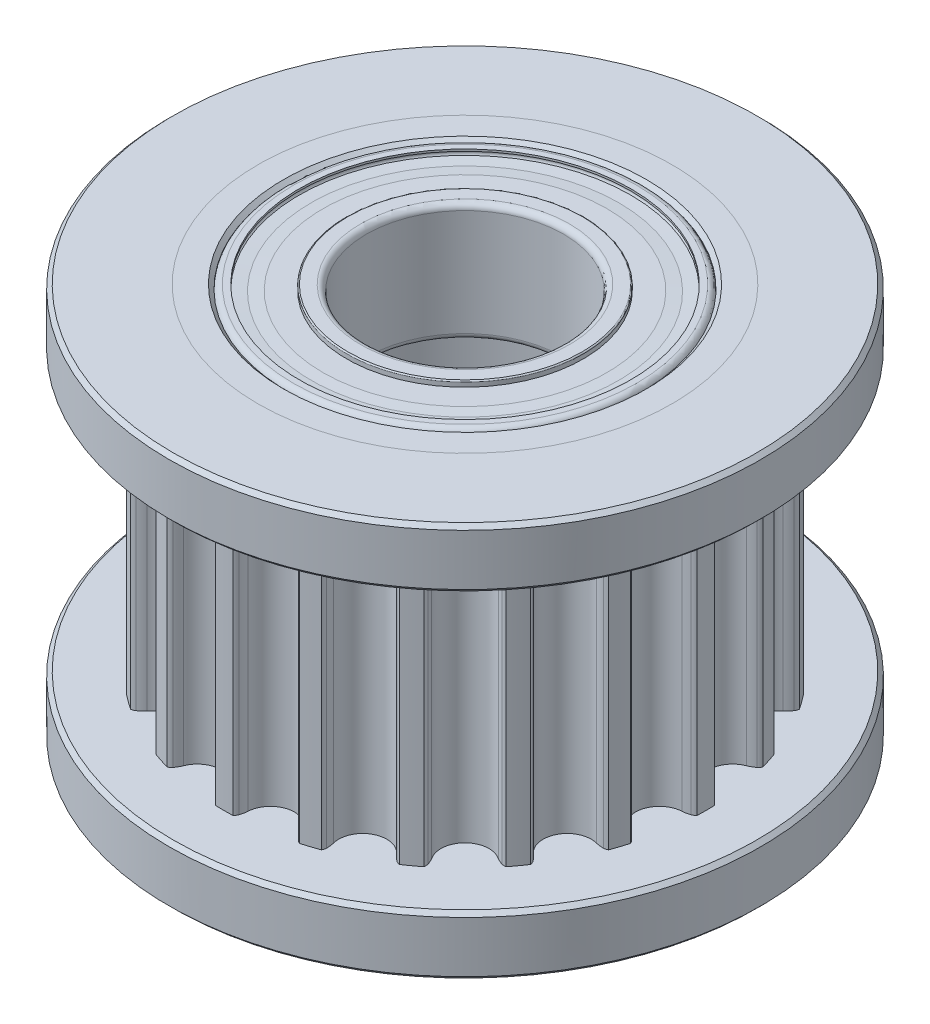
from build123d import *

# Parameters (mm, degrees)
ZKOSEN_1_SIZE            = 0.1
ZAOBLIT1_R               = 0.1
SKICA11_OUTSIDE_W        = 18.214
SKICA11_OUTSIDE_H        = 18.214
ODEBRAT_VYSUNUT_M1_DEPTH = 13.120816804
SKICA10_R                = 7.5
SKICA10_R_2              = 5.25
P_IDAT_VYSUNUT_M1_DEPTH  = 1.5
SKICA12_R                = 7.5
SKICA12_R_2              = 5.25
P_IDAT_VYSUNUT_M2_DEPTH  = 1.5
ZKOSEN_2_SIZE            = 0.1
ZKOSEN_3_SIZE            = 0.1
KRUHOV_POLE1_COUNT       = 8
KRUHOV_POLE3_COUNT       = 8


with BuildPart() as part:
    # Skica1 → Rotovat1 (revolve)
    with BuildSketch(Plane.XY, mode=Mode.PRIVATE) as rotovat1_sk:
        Polygon((4.5, 10), (5.25, 10), (5.25, 8.5), (6.11, 8.5), (6.11, 1.5), (5.25, 1.5), (5.25, 0), (4.5, 0), (4.5, 3), (3.5, 3), (3.5, 7), (4.5, 7), align=None)
    revolve(rotovat1_sk.sketch.rotate(Axis((0, 0, 0), (0, -1, 0)), 90), axis=Axis((0, 0, 0), (0, -1, 0)))

    # Zkosení1
    zkosen_1_edges = [part.edges().sort_by_distance(p)[0] for p in [
        (0, 3, -3.5),
        (0, 0, -4.5),
        (0, 10, -4.5),
        (0, 7, -3.5),
    ]]
    chamfer(zkosen_1_edges, length=ZKOSEN_1_SIZE)

    # Zaoblit1
    zaoblit1_edges = [part.edges().sort_by_distance(p)[0] for p in [
        (0, 3, -4.5),
        (0, 7, -4.5),
    ]]
    fillet(zaoblit1_edges, radius=ZAOBLIT1_R)

    # Skica11 outside → Odebrat vysunutím1 (cut, through all)
    with BuildSketch(Plane(origin=(0, 8.5, 0), x_dir=(1, 0, 0), z_dir=(0, 1, 0))):
        Rectangle(SKICA11_OUTSIDE_W, SKICA11_OUTSIDE_H)
        with BuildLine():
            ThreePointArc((-3.682382953, -4.525571141), (-3.762727315, -3.762727315), (-4.525571141, -3.682382953))
            ThreePointArc((-4.525571141, -3.682382953), (-4.610021183, -3.728793285), (-4.700326133, -3.762419831))
            ThreePointArc((-4.700326133, -3.762419831), (-4.754288274, -3.771323603), (-4.808820948, -3.767154999))
            ThreePointArc((-4.808820948, -3.767154999), (-4.942042114, -3.590603771), (-5.068784705, -3.409345583))
            ThreePointArc((-5.068784705, -3.409345583), (-5.05589776, -3.356193758), (-5.030754552, -3.307624129))
            ThreePointArc((-5.030754552, -3.307624129), (-4.970868041, -3.232130193), (-4.900632695, -3.166155011))
            ThreePointArc((-4.900632695, -3.166155011), (-4.741313017, -2.415819646), (-5.441992836, -2.103675911))
            ThreePointArc((-5.441992836, -2.103675911), (-5.53665118, -2.121718261), (-5.632927465, -2.125793243))
            ThreePointArc((-5.632927465, -2.125793243), (-5.686999927, -2.117586015), (-5.737575413, -2.096769914))
            ThreePointArc((-5.737575413, -2.096769914), (-5.809718941, -1.887692114), (-5.874246448, -1.676139718))
            ThreePointArc((-5.874246448, -1.676139718), (-5.845565418, -1.629571614), (-5.806643965, -1.591148831))
            ThreePointArc((-5.806643965, -1.591148831), (-5.7263596, -1.53785578), (-5.639174364, -1.496813569))
            ThreePointArc((-5.639174364, -1.496813569), (-5.255785967, -0.832434719), (-5.825714356, -0.319046414))
            ThreePointArc((-5.825714356, -0.319046414), (-5.921315183, -0.306954671), (-6.01413861, -0.281079202))
            ThreePointArc((-6.01413861, -0.281079202), (-6.063028405, -0.256564354), (-6.104696021, -0.221138381))
            ThreePointArc((-6.104696021, -0.221138381), (-6.1087, 0), (-6.104696021, 0.221138381))
            ThreePointArc((-6.104696021, 0.221138381), (-6.063028405, 0.256564354), (-6.01413861, 0.281079202))
            ThreePointArc((-6.01413861, 0.281079202), (-5.921315183, 0.306954671), (-5.825714356, 0.319046414))
            ThreePointArc((-5.825714356, 0.319046414), (-5.255785967, 0.832434719), (-5.639174364, 1.496813569))
            ThreePointArc((-5.639174364, 1.496813569), (-5.7263596, 1.53785578), (-5.806643965, 1.591148831))
            ThreePointArc((-5.806643965, 1.591148831), (-5.845565418, 1.629571614), (-5.874246448, 1.676139718))
            ThreePointArc((-5.874246448, 1.676139718), (-5.809718941, 1.887692114), (-5.737575413, 2.096769914))
            ThreePointArc((-5.737575413, 2.096769914), (-5.686999927, 2.117586015), (-5.632927465, 2.125793243))
            ThreePointArc((-5.632927465, 2.125793243), (-5.53665118, 2.121718261), (-5.441992836, 2.103675911))
            ThreePointArc((-5.441992836, 2.103675911), (-4.741313017, 2.415819646), (-4.900632695, 3.166155011))
            ThreePointArc((-4.900632695, 3.166155011), (-4.970868041, 3.232130193), (-5.030754552, 3.307624129))
            ThreePointArc((-5.030754552, 3.307624129), (-5.05589776, 3.356193758), (-5.068784705, 3.409345583))
            ThreePointArc((-5.068784705, 3.409345583), (-4.942042114, 3.590603771), (-4.808820948, 3.767154999))
            ThreePointArc((-4.808820948, 3.767154999), (-4.754288274, 3.771323603), (-4.700326133, 3.762419831))
            ThreePointArc((-4.700326133, 3.762419831), (-4.610021183, 3.728793285), (-4.525571141, 3.682382953))
            ThreePointArc((-4.525571141, 3.682382953), (-3.762727315, 3.762727315), (-3.682382953, 4.525571141))
            ThreePointArc((-3.682382953, 4.525571141), (-3.728793285, 4.610021183), (-3.762419831, 4.700326133))
            ThreePointArc((-3.762419831, 4.700326133), (-3.771323603, 4.754288274), (-3.767154999, 4.808820948))
            ThreePointArc((-3.767154999, 4.808820948), (-3.590603771, 4.942042114), (-3.409345583, 5.068784705))
            ThreePointArc((-3.409345583, 5.068784705), (-3.356193758, 5.05589776), (-3.307624129, 5.030754552))
            ThreePointArc((-3.307624129, 5.030754552), (-3.232130193, 4.970868041), (-3.166155011, 4.900632695))
            ThreePointArc((-3.166155011, 4.900632695), (-2.415819646, 4.741313017), (-2.103675911, 5.441992836))
            ThreePointArc((-2.103675911, 5.441992836), (-2.121718261, 5.53665118), (-2.125793243, 5.632927465))
            ThreePointArc((-2.125793243, 5.632927465), (-2.117586015, 5.686999927), (-2.096769914, 5.737575413))
            ThreePointArc((-2.096769914, 5.737575413), (-1.887692114, 5.809718941), (-1.676139718, 5.874246448))
            ThreePointArc((-1.676139718, 5.874246448), (-1.629571614, 5.845565418), (-1.591148831, 5.806643965))
            ThreePointArc((-1.591148831, 5.806643965), (-1.53785578, 5.7263596), (-1.496813569, 5.639174364))
            ThreePointArc((-1.496813569, 5.639174364), (-0.832434719, 5.255785967), (-0.319046414, 5.825714356))
            ThreePointArc((-0.319046414, 5.825714356), (-0.306954671, 5.921315183), (-0.281079202, 6.01413861))
            ThreePointArc((-0.281079202, 6.01413861), (-0.256564354, 6.063028405), (-0.221138381, 6.104696021))
            ThreePointArc((-0.221138381, 6.104696021), (0, 6.1087), (0.221138381, 6.104696021))
            ThreePointArc((0.221138381, 6.104696021), (0.256564354, 6.063028405), (0.281079202, 6.01413861))
            ThreePointArc((0.281079202, 6.01413861), (0.306954671, 5.921315183), (0.319046414, 5.825714356))
            ThreePointArc((0.319046414, 5.825714356), (0.832434719, 5.255785967), (1.496813569, 5.639174364))
            ThreePointArc((1.496813569, 5.639174364), (1.53785578, 5.7263596), (1.591148831, 5.806643965))
            ThreePointArc((1.591148831, 5.806643965), (1.629571614, 5.845565418), (1.676139718, 5.874246448))
            ThreePointArc((1.676139718, 5.874246448), (1.887692114, 5.809718941), (2.096769914, 5.737575413))
            ThreePointArc((2.096769914, 5.737575413), (2.117586015, 5.686999927), (2.125793243, 5.632927465))
            ThreePointArc((2.125793243, 5.632927465), (2.121718261, 5.53665118), (2.103675911, 5.441992836))
            ThreePointArc((2.103675911, 5.441992836), (2.415819646, 4.741313017), (3.166155011, 4.900632695))
            ThreePointArc((3.166155011, 4.900632695), (3.232130193, 4.970868041), (3.307624129, 5.030754552))
            ThreePointArc((3.307624129, 5.030754552), (3.356193758, 5.05589776), (3.409345583, 5.068784705))
            ThreePointArc((3.409345583, 5.068784705), (3.590603771, 4.942042114), (3.767154999, 4.808820948))
            ThreePointArc((3.767154999, 4.808820948), (3.771323603, 4.754288274), (3.762419831, 4.700326133))
            ThreePointArc((3.762419831, 4.700326133), (3.728793285, 4.610021183), (3.682382953, 4.525571141))
            ThreePointArc((3.682382953, 4.525571141), (3.762727315, 3.762727315), (4.525571141, 3.682382953))
            ThreePointArc((4.525571141, 3.682382953), (4.610021183, 3.728793285), (4.700326133, 3.762419831))
            ThreePointArc((4.700326133, 3.762419831), (4.754288273, 3.771323603), (4.808820948, 3.767154999))
            ThreePointArc((4.808820948, 3.767154999), (4.942042114, 3.590603771), (5.068784705, 3.409345583))
            ThreePointArc((5.068784705, 3.409345583), (5.05589776, 3.356193758), (5.030754552, 3.307624129))
            ThreePointArc((5.030754552, 3.307624129), (4.970868041, 3.232130193), (4.900632695, 3.166155011))
            ThreePointArc((4.900632695, 3.166155011), (4.741313017, 2.415819646), (5.441992836, 2.103675911))
            ThreePointArc((5.441992836, 2.103675911), (5.53665118, 2.121718261), (5.632927465, 2.125793243))
            ThreePointArc((5.632927465, 2.125793243), (5.686999927, 2.117586015), (5.737575413, 2.096769914))
            ThreePointArc((5.737575413, 2.096769914), (5.809718941, 1.887692114), (5.874246448, 1.676139718))
            ThreePointArc((5.874246448, 1.676139718), (5.845565418, 1.629571614), (5.806643965, 1.591148831))
            ThreePointArc((5.806643965, 1.591148831), (5.7263596, 1.53785578), (5.639174364, 1.496813569))
            ThreePointArc((5.639174364, 1.496813569), (5.255785967, 0.832434719), (5.825714356, 0.319046414))
            ThreePointArc((5.825714356, 0.319046414), (5.921315183, 0.306954671), (6.01413861, 0.281079202))
            ThreePointArc((6.01413861, 0.281079202), (6.063028405, 0.256564354), (6.104696021, 0.221138381))
            ThreePointArc((6.104696021, 0.221138381), (6.1087, 0), (6.104696021, -0.221138381))
            ThreePointArc((6.104696021, -0.221138381), (6.063028405, -0.256564354), (6.01413861, -0.281079202))
            ThreePointArc((6.01413861, -0.281079202), (5.921315183, -0.306954671), (5.825714356, -0.319046414))
            ThreePointArc((5.825714356, -0.319046414), (5.255785967, -0.832434719), (5.639174364, -1.496813569))
            ThreePointArc((5.639174364, -1.496813569), (5.7263596, -1.53785578), (5.806643965, -1.591148831))
            ThreePointArc((5.806643965, -1.591148831), (5.845565418, -1.629571614), (5.874246448, -1.676139718))
            ThreePointArc((5.874246448, -1.676139718), (5.809718941, -1.887692114), (5.737575413, -2.096769914))
            ThreePointArc((5.737575413, -2.096769914), (5.686999927, -2.117586015), (5.632927465, -2.125793243))
            ThreePointArc((5.632927465, -2.125793243), (5.53665118, -2.121718261), (5.441992836, -2.103675911))
            ThreePointArc((5.441992836, -2.103675911), (4.741313017, -2.415819646), (4.900632695, -3.166155011))
            ThreePointArc((4.900632695, -3.166155011), (4.970868041, -3.232130193), (5.030754552, -3.307624129))
            ThreePointArc((5.030754552, -3.307624129), (5.05589776, -3.356193758), (5.068784705, -3.409345583))
            ThreePointArc((5.068784705, -3.409345583), (4.942042114, -3.590603771), (4.808820948, -3.767154999))
            ThreePointArc((4.808820948, -3.767154999), (4.754288273, -3.771323603), (4.700326133, -3.762419831))
            ThreePointArc((4.700326133, -3.762419831), (4.610021183, -3.728793285), (4.525571141, -3.682382953))
            ThreePointArc((4.525571141, -3.682382953), (3.762727315, -3.762727315), (3.682382953, -4.525571141))
            ThreePointArc((3.682382953, -4.525571141), (3.728793285, -4.610021183), (3.762419831, -4.700326133))
            ThreePointArc((3.762419831, -4.700326133), (3.771323603, -4.754288274), (3.767154999, -4.808820948))
            ThreePointArc((3.767154999, -4.808820948), (3.590603771, -4.942042114), (3.409345583, -5.068784705))
            ThreePointArc((3.409345583, -5.068784705), (3.356193758, -5.05589776), (3.307624129, -5.030754552))
            ThreePointArc((3.307624129, -5.030754552), (3.232130193, -4.970868041), (3.166155011, -4.900632695))
            ThreePointArc((3.166155011, -4.900632695), (2.415819646, -4.741313017), (2.103675911, -5.441992836))
            ThreePointArc((2.103675911, -5.441992836), (2.121718261, -5.53665118), (2.125793243, -5.632927465))
            ThreePointArc((2.125793243, -5.632927465), (2.117586015, -5.686999927), (2.096769914, -5.737575413))
            ThreePointArc((2.096769914, -5.737575413), (1.887692114, -5.809718941), (1.676139718, -5.874246448))
            ThreePointArc((1.676139718, -5.874246448), (1.629571614, -5.845565418), (1.591148831, -5.806643965))
            ThreePointArc((1.591148831, -5.806643965), (1.53785578, -5.7263596), (1.496813569, -5.639174364))
            ThreePointArc((1.496813569, -5.639174364), (0.832434719, -5.255785967), (0.319046414, -5.825714356))
            ThreePointArc((0.319046414, -5.825714356), (0.306954671, -5.921315183), (0.281079202, -6.01413861))
            ThreePointArc((0.281079202, -6.01413861), (0.256564354, -6.063028405), (0.221138381, -6.104696021))
            ThreePointArc((0.221138381, -6.104696021), (0, -6.1087), (-0.221138381, -6.104696021))
            ThreePointArc((-0.221138381, -6.104696021), (-0.256564354, -6.063028405), (-0.281079202, -6.01413861))
            ThreePointArc((-0.281079202, -6.01413861), (-0.306954671, -5.921315183), (-0.319046414, -5.825714356))
            ThreePointArc((-0.319046414, -5.825714356), (-0.832434719, -5.255785967), (-1.496813569, -5.639174364))
            ThreePointArc((-1.496813569, -5.639174364), (-1.53785578, -5.7263596), (-1.591148831, -5.806643965))
            ThreePointArc((-1.591148831, -5.806643965), (-1.629571614, -5.845565418), (-1.676139718, -5.874246448))
            ThreePointArc((-1.676139718, -5.874246448), (-1.887692114, -5.809718941), (-2.096769914, -5.737575413))
            ThreePointArc((-2.096769914, -5.737575413), (-2.117586015, -5.686999927), (-2.125793243, -5.632927465))
            ThreePointArc((-2.125793243, -5.632927465), (-2.121718261, -5.53665118), (-2.103675911, -5.441992836))
            ThreePointArc((-2.103675911, -5.441992836), (-2.415819646, -4.741313017), (-3.166155011, -4.900632695))
            ThreePointArc((-3.166155011, -4.900632695), (-3.232130193, -4.970868041), (-3.307624129, -5.030754552))
            ThreePointArc((-3.307624129, -5.030754552), (-3.356193758, -5.05589776), (-3.409345583, -5.068784705))
            ThreePointArc((-3.409345583, -5.068784705), (-3.590603771, -4.942042114), (-3.767154999, -4.808820948))
            ThreePointArc((-3.767154999, -4.808820948), (-3.771323603, -4.754288274), (-3.762419831, -4.700326133))
            ThreePointArc((-3.762419831, -4.700326133), (-3.728793285, -4.610021183), (-3.682382953, -4.525571141))
        make_face(mode=Mode.SUBTRACT)
    extrude(amount=-ODEBRAT_VYSUNUT_M1_DEPTH, mode=Mode.SUBTRACT)


with BuildPart() as body_2:
    # Skica10 → Přidat vysunutím1 (new body)
    with BuildSketch(Plane(origin=(0, 10, 0), x_dir=(1, 0, 0), z_dir=(0, 1, 0))):
        with Locations(Location((0, 0, 0), (0, 0, 270))):
            Circle(SKICA10_R)
        with Locations(Location((0, 0, 0), (0, 0, 270))):
            Circle(SKICA10_R_2, mode=Mode.SUBTRACT)
    extrude(amount=-P_IDAT_VYSUNUT_M1_DEPTH)

    # Zkosení2
    zkosen_2_edges = [body_2.edges().sort_by_distance(p)[0] for p in [
        (0, 10, -7.5),
        (0, 8.5, -7.5),
    ]]
    chamfer(zkosen_2_edges, length=ZKOSEN_2_SIZE)


with BuildPart() as body_3:
    # Skica12 → Přidat vysunutím2 (new body)
    with BuildSketch(Plane.XZ):
        with Locations(Location((0, 0, 0), (0, 0, 270))):
            Circle(SKICA12_R)
        with Locations(Location((0, 0, 0), (0, 0, 270))):
            Circle(SKICA12_R_2, mode=Mode.SUBTRACT)
    extrude(amount=-P_IDAT_VYSUNUT_M2_DEPTH)

    # Zkosení3
    zkosen_3_edges = [body_3.edges().sort_by_distance(p)[0] for p in [
        (0, 0, 7.5),
        (0, 1.5, 7.5),
    ]]
    chamfer(zkosen_3_edges, length=ZKOSEN_3_SIZE)


with BuildPart() as body_4:
    # Skica4 → Rotovat2 (revolve)
    with BuildSketch(Plane.XY, mode=Mode.PRIVATE) as rotovat2_sk:
        with BuildLine():
            Line((4.5, 9.85), (4.5, 7.15))
            ThreePointArc((4.5, 7.15), (4.456066017, 7.043933983), (4.35, 7))
            Line((4.35, 7), (4.2, 7))
            Line((4.2, 7), (4.2, 7.05))
            ThreePointArc((4.2, 7.05), (4.289757174, 7.133393211), (4.213177928, 7.229030007))
            Line((4.213177928, 7.229030007), (3.85, 7.282786405))
            Line((3.85, 7.282786405), (3.85, 8.052786405))
            ThreePointArc((3.85, 8.052786405), (4.05, 8.5), (3.85, 8.947213595))
            Line((3.85, 8.947213595), (3.85, 9.717213595))
            Line((3.85, 9.717213595), (4.213177928, 9.770969993))
            ThreePointArc((4.213177928, 9.770969993), (4.289757174, 9.866606789), (4.2, 9.95))
            Line((4.2, 9.95), (4.2, 10))
            Line((4.2, 10), (4.35, 10))
            ThreePointArc((4.35, 10), (4.456066017, 9.956066017), (4.5, 9.85))
        make_face()
    revolve(rotovat2_sk.sketch.rotate(Axis((0, 0, 0), (0, 1, 0)), 90), axis=Axis((0, 0, 0), (0, 1, 0)))


with BuildPart() as body_5:
    # Skica5 → Rotovat3 (revolve)
    with BuildSketch(Plane.XY, mode=Mode.PRIVATE) as rotovat3_sk:
        with BuildLine():
            Line((2.5, 9.85), (2.5, 7.15))
            ThreePointArc((2.5, 7.15), (2.543933983, 7.043933983), (2.65, 7))
            Line((2.65, 7), (2.97, 7))
            ThreePointArc((2.97, 7), (2.991213203, 7.008786797), (3, 7.03))
            Line((3, 7.03), (3, 7.14))
            Line((3, 7.14), (3.6, 7.14))
            Line((3.6, 7.14), (3.896185034, 7.191714847))
            Line((3.896185034, 7.191714847), (4.192370069, 7.14))
            Line((4.192370069, 7.14), (4.192370069, 7.19))
            Line((4.192370069, 7.19), (3.897467562, 7.258062558))
            Line((3.897467562, 7.258062558), (3.597467562, 7.258062558))
            Line((3.597467562, 7.258062558), (3, 7.19))
            Line((3, 7.19), (3, 8.103137303))
            ThreePointArc((3, 8.103137303), (2.85, 8.5), (3, 8.896862697))
            Line((3, 8.896862697), (3, 9.81))
            Line((3, 9.81), (3.6, 9.77))
            Line((3.6, 9.77), (3.9, 9.77))
            Line((3.9, 9.77), (4.2, 9.81))
            Line((4.2, 9.81), (4.2, 9.86))
            Line((4.2, 9.86), (3.9, 9.84))
            Line((3.9, 9.84), (3.6, 9.86))
            Line((3.6, 9.86), (3, 9.86))
            Line((3, 9.86), (3, 9.97))
            ThreePointArc((3, 9.97), (2.991213203, 9.991213203), (2.97, 10))
            Line((2.97, 10), (2.65, 10))
            ThreePointArc((2.65, 10), (2.543933983, 9.956066017), (2.5, 9.85))
        make_face()
    revolve(rotovat3_sk.sketch.rotate(Axis((0, 0, 0), (0, 1, 0)), 90), axis=Axis((0, 0, 0), (0, 1, 0)))


with BuildPart() as body_6:
    # Skica6 → Rotovat4 (revolve)
    with BuildSketch(Plane.XY):
        with BuildLine():
            Line((3.45, 9.1), (3.45, 7.9))
            ThreePointArc((3.45, 7.9), (4.05, 8.5), (3.45, 9.1))
        make_face()
    revolve(axis=Axis((3.45, 9.1, 0), (0, -1, 0)))


with BuildPart() as kruhov_pole1_1:
    # Kruhové pole1: pattern copy
    add(body_6.part.rotate(Axis((0, 0, 0), (0, 1, 0)), 1 * 360 / KRUHOV_POLE1_COUNT))


with BuildPart() as kruhov_pole1_2:
    # Kruhové pole1: pattern copy
    add(body_6.part.rotate(Axis((0, 0, 0), (0, 1, 0)), 2 * 360 / KRUHOV_POLE1_COUNT))


with BuildPart() as kruhov_pole1_3:
    # Kruhové pole1: pattern copy
    add(body_6.part.rotate(Axis((0, 0, 0), (0, 1, 0)), 3 * 360 / KRUHOV_POLE1_COUNT))


with BuildPart() as kruhov_pole1_4:
    # Kruhové pole1: pattern copy
    add(body_6.part.rotate(Axis((0, 0, 0), (0, 1, 0)), 4 * 360 / KRUHOV_POLE1_COUNT))


with BuildPart() as kruhov_pole1_5:
    # Kruhové pole1: pattern copy
    add(body_6.part.rotate(Axis((0, 0, 0), (0, 1, 0)), 5 * 360 / KRUHOV_POLE1_COUNT))


with BuildPart() as kruhov_pole1_6:
    # Kruhové pole1: pattern copy
    add(body_6.part.rotate(Axis((0, 0, 0), (0, 1, 0)), 6 * 360 / KRUHOV_POLE1_COUNT))


with BuildPart() as kruhov_pole1_7:
    # Kruhové pole1: pattern copy
    add(body_6.part.rotate(Axis((0, 0, 0), (0, 1, 0)), 7 * 360 / KRUHOV_POLE1_COUNT))


with BuildPart() as body_14:
    # Skica7 → Rotovat5 (revolve)
    with BuildSketch(Plane.XY, mode=Mode.PRIVATE) as rotovat5_sk:
        with BuildLine():
            Line((4.5, 2.85), (4.5, 0.15))
            ThreePointArc((4.5, 0.15), (4.456066017, 0.043933983), (4.35, 0))
            Line((4.35, 0), (4.2, 0))
            Line((4.2, 0), (4.2, 0.05))
            ThreePointArc((4.2, 0.05), (4.289757174, 0.133393211), (4.213177928, 0.229030007))
            Line((4.213177928, 0.229030007), (3.85, 0.282786405))
            Line((3.85, 0.282786405), (3.85, 1.052786405))
            ThreePointArc((3.85, 1.052786405), (4.05, 1.5), (3.85, 1.947213595))
            Line((3.85, 1.947213595), (3.85, 2.717213595))
            Line((3.85, 2.717213595), (4.213177928, 2.770969993))
            ThreePointArc((4.213177928, 2.770969993), (4.289757174, 2.866606789), (4.2, 2.95))
            Line((4.2, 2.95), (4.2, 3))
            Line((4.2, 3), (4.35, 3))
            ThreePointArc((4.35, 3), (4.456066017, 2.956066017), (4.5, 2.85))
        make_face()
    revolve(rotovat5_sk.sketch.rotate(Axis((0, 0, 0), (0, 1, 0)), 90), axis=Axis((0, 0, 0), (0, 1, 0)))


with BuildPart() as body_15:
    # Skica8 → Rotovat6 (revolve)
    with BuildSketch(Plane.XY, mode=Mode.PRIVATE) as rotovat6_sk:
        with BuildLine():
            Line((2.5, 2.85), (2.5, 0.15))
            ThreePointArc((2.5, 0.15), (2.543933983, 0.043933983), (2.65, 0))
            Line((2.65, 0), (2.97, 0))
            ThreePointArc((2.97, 0), (2.991213203, 0.008786797), (3, 0.03))
            Line((3, 0.03), (3, 0.14))
            Line((3, 0.14), (3.6, 0.14))
            Line((3.6, 0.14), (3.896185034, 0.191714847))
            Line((3.896185034, 0.191714847), (4.192370069, 0.14))
            Line((4.192370069, 0.14), (4.192370069, 0.19))
            Line((4.192370069, 0.19), (3.897467562, 0.258062558))
            Line((3.897467562, 0.258062558), (3.597467562, 0.258062558))
            Line((3.597467562, 0.258062558), (3, 0.19))
            Line((3, 0.19), (3, 1.103137303))
            ThreePointArc((3, 1.103137303), (2.85, 1.5), (3, 1.896862697))
            Line((3, 1.896862697), (3, 2.81))
            Line((3, 2.81), (3.6, 2.77))
            Line((3.6, 2.77), (3.9, 2.77))
            Line((3.9, 2.77), (4.2, 2.81))
            Line((4.2, 2.81), (4.2, 2.86))
            Line((4.2, 2.86), (3.9, 2.84))
            Line((3.9, 2.84), (3.6, 2.86))
            Line((3.6, 2.86), (3, 2.86))
            Line((3, 2.86), (3, 2.97))
            ThreePointArc((3, 2.97), (2.991213203, 2.991213203), (2.97, 3))
            Line((2.97, 3), (2.65, 3))
            ThreePointArc((2.65, 3), (2.543933983, 2.956066017), (2.5, 2.85))
        make_face()
    revolve(rotovat6_sk.sketch.rotate(Axis((0, 0, 0), (0, -1, 0)), 180), axis=Axis((0, 0, 0), (0, -1, 0)))


with BuildPart() as body_16:
    # Skica9 → Rotovat7 (revolve)
    with BuildSketch(Plane.XY):
        with BuildLine():
            Line((3.45, 2.1), (3.45, 0.9))
            ThreePointArc((3.45, 0.9), (4.05, 1.5), (3.45, 2.1))
        make_face()
    revolve(axis=Axis((3.45, 2.1, 0), (0, -1, 0)))


with BuildPart() as kruhov_pole3_1:
    # Kruhové pole3: pattern copy
    add(body_16.part.rotate(Axis((0, 0, 0), (0, 1, 0)), 1 * 360 / KRUHOV_POLE3_COUNT))


with BuildPart() as kruhov_pole3_2:
    # Kruhové pole3: pattern copy
    add(body_16.part.rotate(Axis((0, 0, 0), (0, 1, 0)), 2 * 360 / KRUHOV_POLE3_COUNT))


with BuildPart() as kruhov_pole3_3:
    # Kruhové pole3: pattern copy
    add(body_16.part.rotate(Axis((0, 0, 0), (0, 1, 0)), 3 * 360 / KRUHOV_POLE3_COUNT))


with BuildPart() as kruhov_pole3_4:
    # Kruhové pole3: pattern copy
    add(body_16.part.rotate(Axis((0, 0, 0), (0, 1, 0)), 4 * 360 / KRUHOV_POLE3_COUNT))


with BuildPart() as kruhov_pole3_5:
    # Kruhové pole3: pattern copy
    add(body_16.part.rotate(Axis((0, 0, 0), (0, 1, 0)), 5 * 360 / KRUHOV_POLE3_COUNT))


with BuildPart() as kruhov_pole3_6:
    # Kruhové pole3: pattern copy
    add(body_16.part.rotate(Axis((0, 0, 0), (0, 1, 0)), 6 * 360 / KRUHOV_POLE3_COUNT))


with BuildPart() as kruhov_pole3_7:
    # Kruhové pole3: pattern copy
    add(body_16.part.rotate(Axis((0, 0, 0), (0, 1, 0)), 7 * 360 / KRUHOV_POLE3_COUNT))


solid = Compound([part.part, body_2.part, body_3.part, body_4.part, body_5.part, body_6.part, kruhov_pole1_1.part, kruhov_pole1_2.part, kruhov_pole1_3.part, kruhov_pole1_4.part, kruhov_pole1_5.part, kruhov_pole1_6.part, kruhov_pole1_7.part, body_14.part, body_15.part, body_16.part, kruhov_pole3_1.part, kruhov_pole3_2.part, kruhov_pole3_3.part, kruhov_pole3_4.part, kruhov_pole3_5.part, kruhov_pole3_6.part, kruhov_pole3_7.part])
